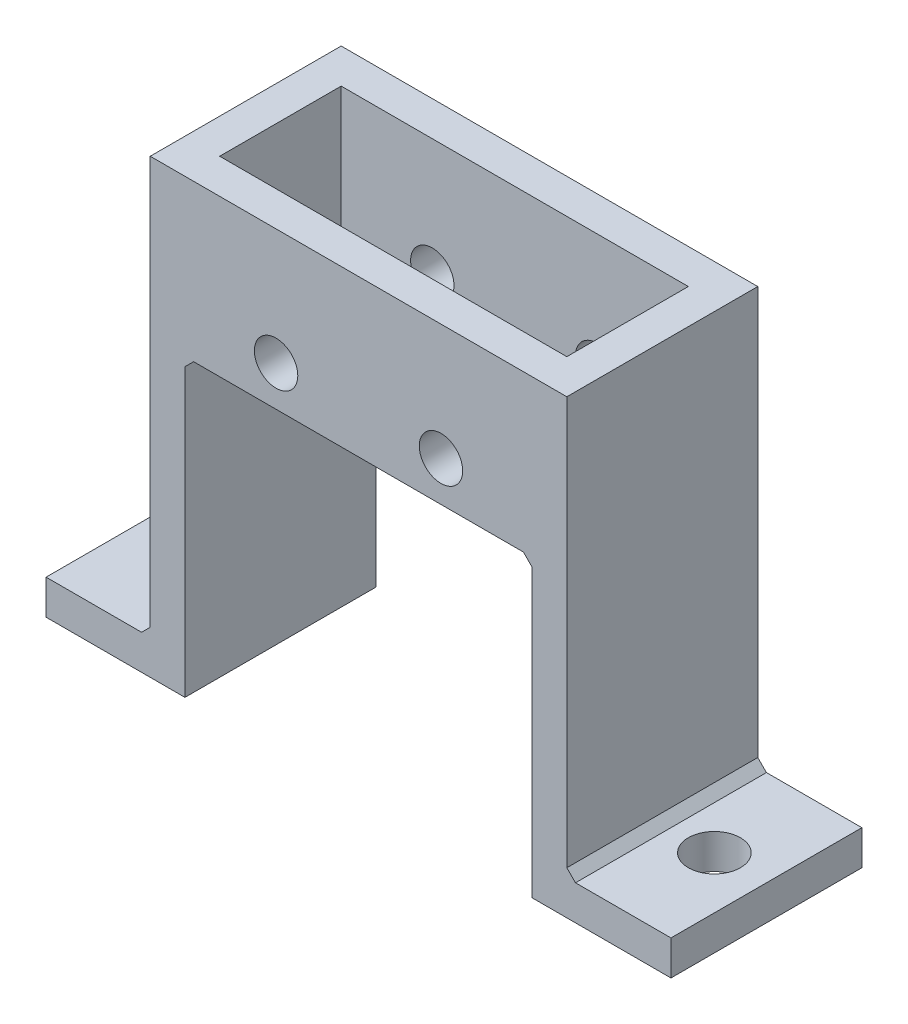
from build123d import *

# Parameters (mm, degrees)
CROQUIS1_W              = 20
CROQUIS1_H              = 10
CROQUIS1_R              = 1.25
SALIENTE_EXTRUIR1_DEPTH = 2
CROQUIS2_W              = 2
CROQUIS2_H              = 10
SALIENTE_EXTRUIR2_DEPTH = 11
CROQUIS3_W              = 20
CROQUIS3_H              = 10
CROQUIS3_R              = 1.25
SALIENTE_EXTRUIR3_DEPTH = 2
CROQUIS4_W              = 2
CROQUIS4_H              = 11
SALIENTE_EXTRUIR4_DEPTH = 17
CROQUIS5_W              = 11
CROQUIS5_H              = 2
SALIENTE_EXTRUIR5_DEPTH = 6
CROQUIS6_W              = 11
CROQUIS6_H              = 2
SALIENTE_EXTRUIR6_DEPTH = 6
CROQUIS7_W              = 24
CROQUIS7_H              = 11
CROQUIS7_W_2            = 20
CROQUIS7_H_2            = 7
CORTAR_EXTRUIR1_DEPTH   = 1
CROQUIS8_R              = 1.5
CORTAR_EXTRUIR2_DEPTH   = 11
CHAFL_N1_SIZE           = 0.5


with BuildPart() as part:
    # Croquis1 → Saliente-Extruir1 (new body)
    with BuildSketch(Plane.XY):
        with Locations((10, 5)):
            Rectangle(CROQUIS1_W, CROQUIS1_H)
        with Locations((5.25, 2.3)):
            Circle(CROQUIS1_R, mode=Mode.SUBTRACT)
        with Locations((14.75, 2.3)):
            Circle(CROQUIS1_R, mode=Mode.SUBTRACT)
    extrude(amount=SALIENTE_EXTRUIR1_DEPTH)

    # Croquis2 → Saliente-Extruir2 (add)
    with BuildSketch(Plane.XY.offset(2)):
        with Locations((-1, 5)):
            Rectangle(CROQUIS2_W, CROQUIS2_H)
        with Locations((21, 5)):
            Rectangle(CROQUIS2_W, CROQUIS2_H)
    extrude(amount=-SALIENTE_EXTRUIR2_DEPTH)



with BuildPart() as body_2:
    # Croquis3 → Saliente-Extruir3 (new body)
    with BuildSketch(Plane(origin=(0, 0, -9), x_dir=(-1, 0, 0), z_dir=(0, 0, -1))):
        with Locations((-10, 5)):
            Rectangle(CROQUIS3_W, CROQUIS3_H)
        with Locations(Location((-5.25, 2.3, 0), (0, 0, 180))):
            Circle(CROQUIS3_R, mode=Mode.SUBTRACT)
        with Locations(Location((-14.75, 2.3, 0), (0, 0, 180))):
            Circle(CROQUIS3_R, mode=Mode.SUBTRACT)
    extrude(amount=-SALIENTE_EXTRUIR3_DEPTH)


with BuildPart() as part_1:
    add(part.part)

    add(body_2.part)  # Saliente-Extruir4 merges body 2
    # Croquis4 → Saliente-Extruir4 (add)
    with BuildSketch(Plane.XZ):
        with Locations((-1, -3.5)):
            Rectangle(CROQUIS4_W, CROQUIS4_H)
        with Locations((21, -3.5)):
            Rectangle(CROQUIS4_W, CROQUIS4_H)
    extrude(amount=SALIENTE_EXTRUIR4_DEPTH)

    # Croquis5 → Saliente-Extruir5 (add)
    with BuildSketch(Plane(origin=(22, 0, 0), x_dir=(0, 0, -1), z_dir=(1, 0, 0))):
        with Locations((3.5, -16)):
            Rectangle(CROQUIS5_W, CROQUIS5_H)
    extrude(amount=SALIENTE_EXTRUIR5_DEPTH)

    # Croquis6 → Saliente-Extruir6 (add)
    with BuildSketch(Plane.ZY.offset(2)):
        with Locations((-3.5, -16)):
            Rectangle(CROQUIS6_W, CROQUIS6_H)
    extrude(amount=SALIENTE_EXTRUIR6_DEPTH)

    # Croquis7 → Cortar-Extruir1 (cut)
    with BuildSketch(Plane(origin=(0, 10, 0), x_dir=(1, 0, 0), z_dir=(0, 1, 0))):
        with Locations((10, 3.5)):
            Rectangle(CROQUIS7_W, CROQUIS7_H)
        with Locations((10, 3.5)):
            Rectangle(CROQUIS7_W_2, CROQUIS7_H_2, mode=Mode.SUBTRACT)
    extrude(amount=-CORTAR_EXTRUIR1_DEPTH, mode=Mode.SUBTRACT)

    # Croquis8 → Cortar-Extruir2 (cut)
    with BuildSketch(Plane(origin=(0, -15, 0), x_dir=(1, 0, 0), z_dir=(0, 1, 0))):
        with Locations(Location((-5, 3.5, 0), (0, 0, 180))):
            Circle(CROQUIS8_R)
        with Locations(Location((25, 3.5, 0), (0, 0, 180))):
            Circle(CROQUIS8_R)
    extrude(amount=-CORTAR_EXTRUIR2_DEPTH, mode=Mode.SUBTRACT)

    # Chaflán1
    chafl_n1_edges = [part_1.edges().sort_by_distance(p)[0] for p in [
        (-2, -15, -3.5),
        (0, 0, 1),
        (0, 0, -8),
        (20, 0, 1),
        (20, 0, -8),
        (22, -15, -3.5),
    ]]
    chamfer(chafl_n1_edges, length=CHAFL_N1_SIZE)


solid = part_1.part
